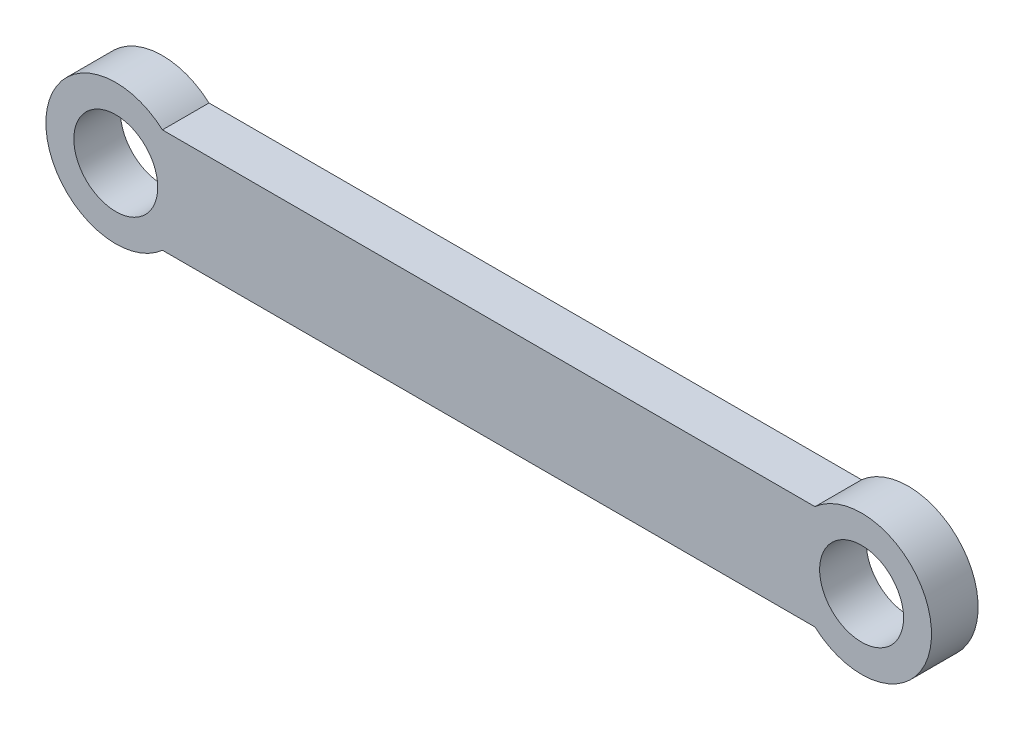
from build123d import *

# Parameters (mm, degrees)
SKETCH_1_R      = 4.5
EXTRUDE_1_DEPTH = 5


with BuildPart() as part:
    # 스케치1 → 보스-돌출1 (new body)
    with BuildSketch(Plane.XY):
        with BuildLine():
            Line((5, 5.590169944), (75, 5.590169944))
            ThreePointArc((75, 5.590169944), (87.5, 0), (75, -5.590169944))
            Line((75, -5.590169944), (5, -5.590169944))
            ThreePointArc((5, -5.590169944), (-7.5, 0), (5, 5.590169944))
        make_face()
        Circle(SKETCH_1_R, mode=Mode.SUBTRACT)
        with Locations((80, 0)):
            Circle(SKETCH_1_R, mode=Mode.SUBTRACT)
    extrude(amount=EXTRUDE_1_DEPTH)


solid = part.part
